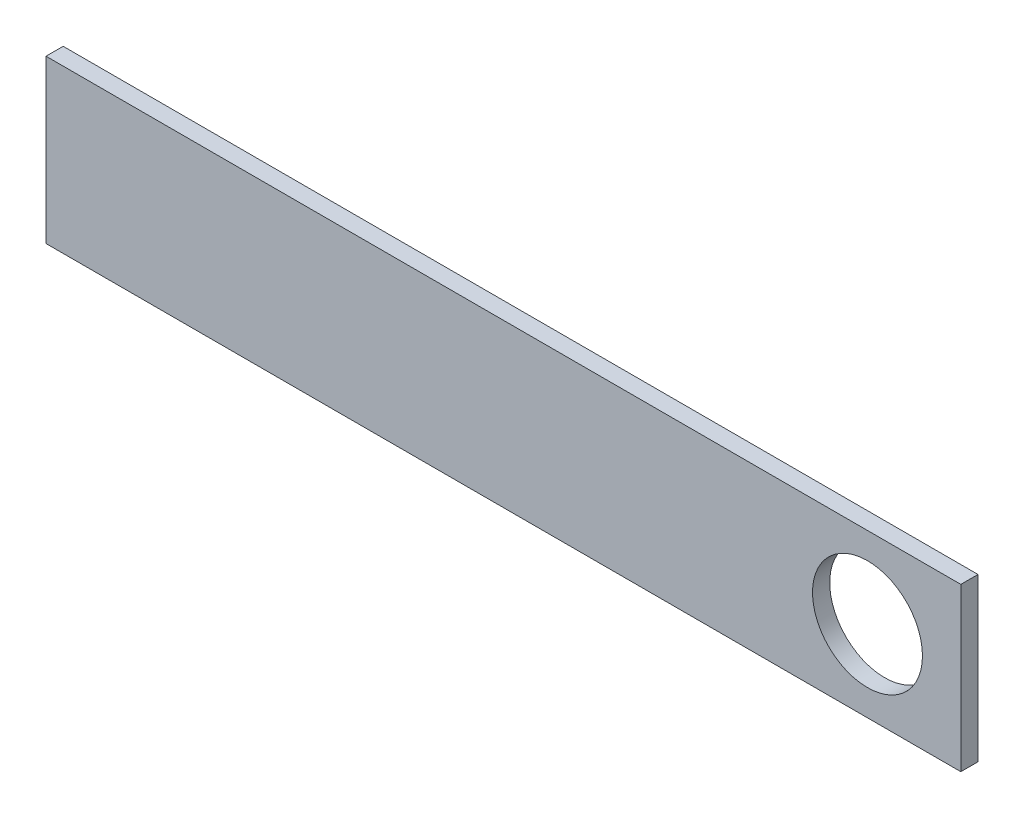
from build123d import *

# Parameters (mm, degrees)
SKETCH1_W           = 135.321335131
SKETCH1_H           = 24.000335308
BOSS_EXTRUDE1_DEPTH = 2.54
SKETCH2_R           = 8.130119586
CUT_EXTRUDE1_DEPTH  = 100.516626939


with BuildPart() as part:
    # Sketch1 → Boss-Extrude1 (new body)
    with BuildSketch(Plane.XY):
        with Locations((-0.195443485, -60.750472416)):
            Rectangle(SKETCH1_W, SKETCH1_H)
    extrude(amount=-BOSS_EXTRUDE1_DEPTH)

    # Sketch2 → Cut-Extrude1 (cut, through all)
    with BuildSketch(Plane.XY):
        with Locations((53.659302676, -60.750472416)):
            Circle(SKETCH2_R)
    extrude(amount=-CUT_EXTRUDE1_DEPTH, mode=Mode.SUBTRACT)


solid = part.part
